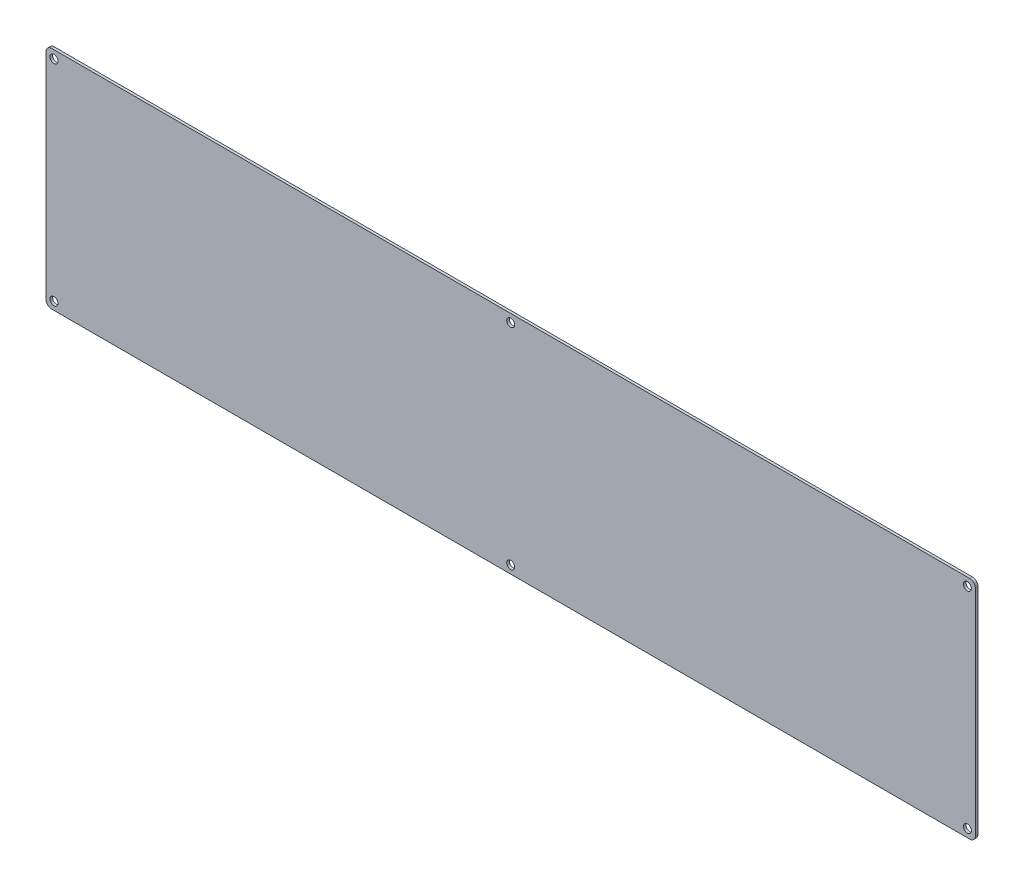
from build123d import *

# Parameters (mm, degrees)
EXTRUDE_1_DEPTH          = 2.3
CUT_EXTRUDE_1_DEPTH      = 839.70989621
CUT_EXTRUDE_1_DEPTH_BACK = 839.70989621
SKETCH_2_R               = 3.5


with BuildPart() as part:
    # ｽｹｯﾁ1 → ﾎﾞｽ - 押し出し1 (new body)
    with BuildSketch(Plane.XY):
        with BuildLine():
            Line((5, 0), (810, 0))
            ThreePointArc((810, 0), (813.535533906, 1.464466094), (815, 5))
            Line((815, 5), (815, 193))
            ThreePointArc((815, 193), (813.535533906, 196.535533906), (810, 198))
            Line((810, 198), (5, 198))
            ThreePointArc((5, 198), (1.464466094, 196.535533906), (0, 193))
            Line((0, 193), (0, 5))
            ThreePointArc((0, 5), (1.464466094, 1.464466094), (5, 0))
        make_face()
    extrude(amount=EXTRUDE_1_DEPTH)

    # ｽｹｯﾁ2 → ｶｯﾄ - 押し出し1 (cut, two sides: drawn at the far end of the back side and taken through both)
    with BuildSketch(Plane.XY.offset(-CUT_EXTRUDE_1_DEPTH_BACK)):
        with Locations((7, 7)):
            Circle(SKETCH_2_R)
        with Locations((7, 191)):
            Circle(SKETCH_2_R)
        with Locations((407.5, 7)):
            Circle(SKETCH_2_R)
        with Locations((407.5, 191)):
            Circle(SKETCH_2_R)
        with Locations((808, 7)):
            Circle(SKETCH_2_R)
        with Locations((808, 191)):
            Circle(SKETCH_2_R)
    extrude(amount=CUT_EXTRUDE_1_DEPTH + CUT_EXTRUDE_1_DEPTH_BACK, mode=Mode.SUBTRACT)


solid = part.part
